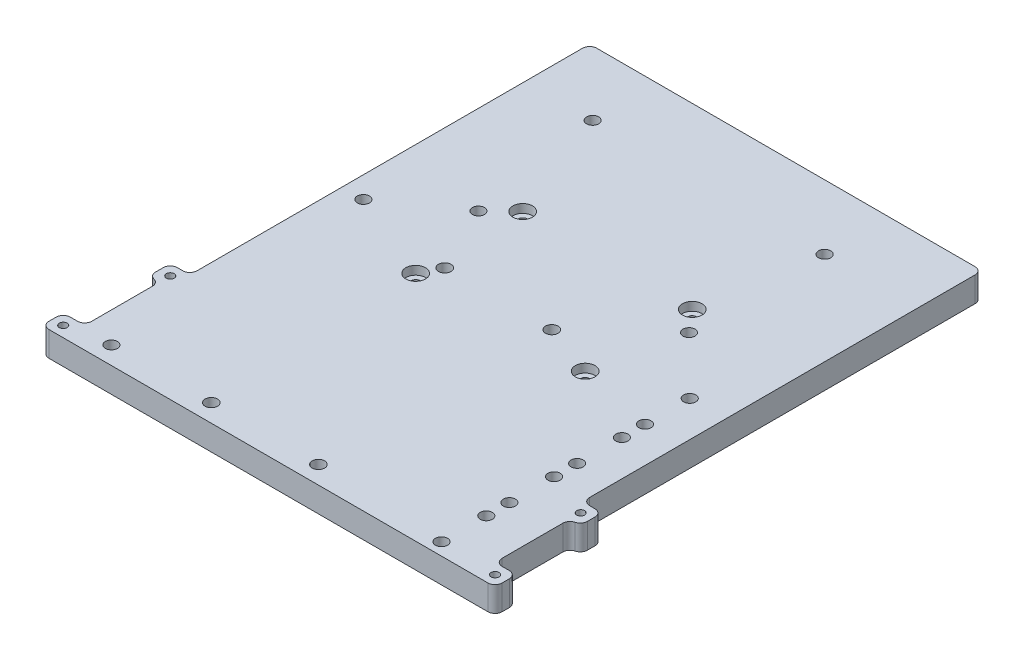
from build123d import *

# Parameters (mm, degrees)
SKETCH2_R                    = 1.5875
MAINPLATE_DEPTH              = 8.89
SKETCH3_R                    = 3.4925
CASTERWHEEL_MOUNTHOLES_DEPTH = 3.048
SKETCH4_R                    = 2.159
ARDUINO_MOUNTHOLES_DEPTH     = 6.35
SKETCH5_R                    = 2.159
PDB_16A_MOUNTINGHOLES_DEPTH  = 6.35
SKETCH6_R                    = 2.232248555
PDB_15A_MOUNTINGHOLES_DEPTH  = 6.35
SKETCH7_R                    = 2.159
DRV8871_MOUNTINGHOLES_DEPTH  = 6.35
DRV8871_MOUNTPATTERN_COUNT   = 4
DRV8871_MOUNTPATTERN_PITCH   = 24.13
SKETCH8_R                    = 1.397
BOSS_EXTRUDE1_DEPTH          = 8.89
FILLET1_R                    = 2.54
FILLET2_R                    = 2.54


with BuildPart() as part:
    # Sketch2 → MainPlate (new body)
    with BuildSketch(Plane(origin=(0, 0, 0), x_dir=(1, 0, 0), z_dir=(0, 1, 0))):
        Polygon((-69.85, 0), (-69.85, 82.55), (69.85, 82.55), (69.85, 0), (69.85, -101.6), (-69.85, -101.6), align=None)
        with Locations(Location((30.1625, 19.05, 0), (0, 0, 270))):
            Circle(SKETCH2_R, mode=Mode.SUBTRACT)
        with Locations(Location((30.1625, -19.05, 0), (0, 0, 270))):
            Circle(SKETCH2_R, mode=Mode.SUBTRACT)
        with Locations(Location((-30.1625, -19.05, 0), (0, 0, 270))):
            Circle(SKETCH2_R, mode=Mode.SUBTRACT)
        with Locations(Location((-30.1625, 19.05, 0), (0, 0, 270))):
            Circle(SKETCH2_R, mode=Mode.SUBTRACT)
    extrude(amount=MAINPLATE_DEPTH)

    # Sketch3 → CasterWheel_MountHoles (cut)
    with BuildSketch(Plane(origin=(0, 8.89, 0), x_dir=(1, 0, 0), z_dir=(0, 1, 0))):
        with Locations(Location((-30.1625, 19.05, 0), (0, 0, 270))):
            Circle(SKETCH3_R)
        with Locations(Location((30.1625, 19.05, 0), (0, 0, 270))):
            Circle(SKETCH3_R)
        with Locations(Location((-30.1625, -19.05, 0), (0, 0, 270))):
            Circle(SKETCH3_R)
        with Locations(Location((30.1625, -19.05, 0), (0, 0, 270))):
            Circle(SKETCH3_R)
    extrude(amount=-CASTERWHEEL_MOUNTHOLES_DEPTH, mode=Mode.SUBTRACT)

    # Sketch4 → Arduino_MountHoles (cut)
    with BuildSketch(Plane(origin=(0, 8.89, 0), x_dir=(1, 0, 0), z_dir=(0, 1, 0))):
        with Locations(Location((-45.812177419, 59.587580645, 0), (0, 0, 270))):
            Circle(SKETCH4_R)
        with Locations(Location((-38.192177419, 11.327580645, 0), (0, 0, 270))):
            Circle(SKETCH4_R)
        with Locations(Location((36.737822581, 59.587580645, 0), (0, 0, 270))):
            Circle(SKETCH4_R)
        with Locations(Location((36.737822581, 11.327580645, 0), (0, 0, 270))):
            Circle(SKETCH4_R)
    extrude(amount=-ARDUINO_MOUNTHOLES_DEPTH, mode=Mode.SUBTRACT)

    # Sketch5 → PDB_16A_MountingHoles (cut)
    with BuildSketch(Plane(origin=(0, 8.89, 0), x_dir=(1, 0, 0), z_dir=(0, 1, 0))):
        with Locations(Location((-62.23, -5.588, 0), (0, 0, 270))):
            Circle(SKETCH5_R)
        with Locations(Location((-62.23, -95.25, 0), (0, 0, 270))):
            Circle(SKETCH5_R)
    extrude(amount=-PDB_16A_MOUNTINGHOLES_DEPTH, mode=Mode.SUBTRACT)

    # Sketch6 → PDB_15A_MountingHoles (cut)
    with BuildSketch(Plane(origin=(0, 8.89, 0), x_dir=(1, 0, 0), z_dir=(0, 1, 0))):
        with Locations(Location((-26.67, -95.25, 0), (0, 0, 270))):
            Circle(SKETCH6_R)
        with Locations(Location((-26.67, -12.192, 0), (0, 0, 270))):
            Circle(SKETCH6_R)
        with Locations(Location((11.43, -12.192, 0), (0, 0, 90))):
            Circle(SKETCH6_R)
        with Locations(Location((11.43, -95.25, 0), (0, 0, 90))):
            Circle(SKETCH6_R)
    extrude(amount=-PDB_15A_MOUNTINGHOLES_DEPTH, mode=Mode.SUBTRACT)

    # Sketch7 → DRV8871_MountingHoles (cut)
    with BuildSketch(Plane(origin=(0, 8.89, 0), x_dir=(1, 0, 0), z_dir=(0, 1, 0))):
        with Locations(Location((57.15, -97.155, 0), (0, 0, 270))):
            Circle(SKETCH7_R)
        with Locations(Location((57.15, -81.2165, 0), (0, 0, 270))):
            Circle(SKETCH7_R)
    drv8871_mountingholes = extrude(amount=-DRV8871_MOUNTINGHOLES_DEPTH, mode=Mode.SUBTRACT)

    # DRV8871_MountPattern: DRV8871_MountingHoles ×4
    with Locations(*[(0, 0, -i * DRV8871_MOUNTPATTERN_PITCH) for i in range(1, DRV8871_MOUNTPATTERN_COUNT)]):
        add(drv8871_mountingholes, mode=Mode.SUBTRACT)

    # Sketch8 → Boss-Extrude1 (add)
    with BuildSketch(Plane.XZ):
        Polygon((-69.85, 101.6), (-69.85, 66.675), (69.85, 66.675), (69.85, 101.6), (80.645, 101.6), (80.645, 93.98), (73.025, 93.98), (73.025, 67.31), (76.835, 67.31), (76.835, 59.69), (69.215, 59.69), (69.215, 63.5), (-69.215, 63.5), (-69.215, 59.69), (-76.835, 59.69), (-76.835, 67.31), (-73.025, 67.31), (-73.025, 93.98), (-80.645, 93.98), (-80.645, 101.6), align=None)
        with Locations(Location((-76.835, 97.79, 0), (0, 0, 270))):
            Circle(SKETCH8_R, mode=Mode.SUBTRACT)
        with Locations(Location((-73.025, 63.5, 0), (0, 0, 270))):
            Circle(SKETCH8_R, mode=Mode.SUBTRACT)
        with Locations(Location((73.025, 63.5, 0), (0, 0, 90))):
            Circle(SKETCH8_R, mode=Mode.SUBTRACT)
        with Locations(Location((76.835, 97.79, 0), (0, 0, 90))):
            Circle(SKETCH8_R, mode=Mode.SUBTRACT)
    extrude(amount=-BOSS_EXTRUDE1_DEPTH)

    # Fillet1
    fillet1_edges = [part.edges().sort_by_distance(p)[0] for p in [
        (-69.85, 4.445, 59.69),
        (69.85, 4.445, 59.69),
        (73.025, 4.445, 93.98),
        (73.025, 4.445, 67.31),
        (-73.025, 4.445, 67.31),
        (-73.025, 4.445, 93.98),
    ]]
    fillet(fillet1_edges, radius=FILLET1_R)

    # Fillet2
    fillet2_edges = [part.edges().sort_by_distance(p)[0] for p in [
        (-69.85, 4.445, -82.55),
        (-76.835, 4.445, 59.69),
        (-76.835, 4.445, 67.31),
        (-80.645, 4.445, 93.98),
        (-80.645, 4.445, 101.6),
        (69.85, 4.445, -82.55),
        (76.835, 4.445, 59.69),
        (76.835, 4.445, 67.31),
        (80.645, 4.445, 93.98),
        (80.645, 4.445, 101.6),
    ]]
    fillet(fillet2_edges, radius=FILLET2_R)


solid = part.part
